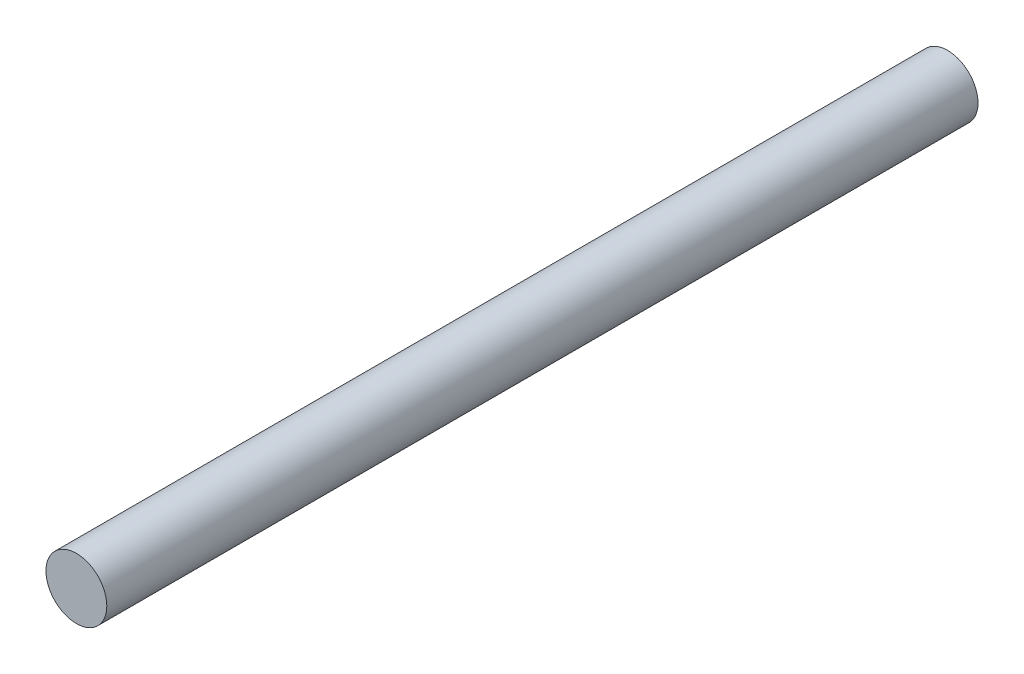
from build123d import *

# Parameters (mm, degrees)
SKETCH1_R           = 1.74625
BOSS_EXTRUDE1_DEPTH = 50


with BuildPart() as part:
    # Sketch1 → Boss-Extrude1 (new body)
    with BuildSketch(Plane.XY):
        Circle(SKETCH1_R)
    extrude(amount=BOSS_EXTRUDE1_DEPTH)


solid = part.part
